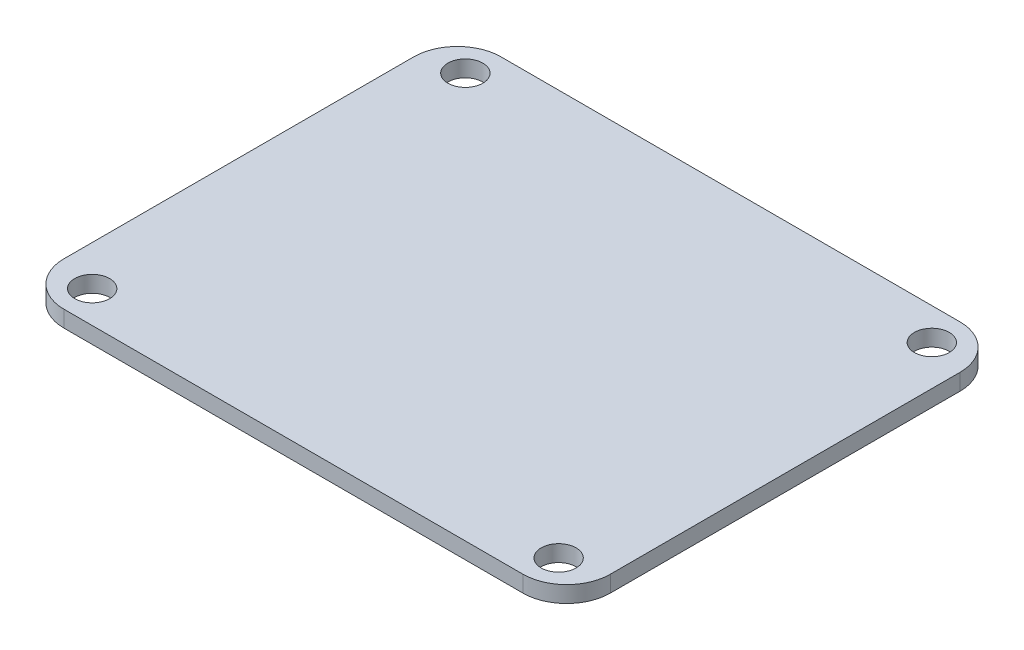
from build123d import *

# Parameters (mm, degrees)
SKETCH_1_R      = 1.597606998
EXTRUDE_1_DEPTH = 1.5


with BuildPart() as part:
    # Эскиз1 → Бобышка-Вытянуть1 (new body)
    with BuildSketch(Plane(origin=(0, 0, 0), x_dir=(1, 0, 0), z_dir=(0, 1, 0))):
        with BuildLine():
            Line((-16, -20), (26, -20))
            ThreePointArc((26, -20), (28.828427125, -18.828427125), (30, -16))
            Line((30, -16), (30, 16))
            ThreePointArc((30, 16), (28.828427125, 18.828427125), (26, 20))
            Line((26, 20), (-16, 20))
            ThreePointArc((-16, 20), (-18.828427125, 18.828427125), (-20, 16))
            Line((-20, 16), (-20, -16))
            ThreePointArc((-20, -16), (-18.828427125, -18.828427125), (-16, -20))
        make_face()
        with Locations(Location((-16.343796559, 17.075037247, 0), (0, 0, 270))):
            Circle(SKETCH_1_R, mode=Mode.SUBTRACT)
        with Locations(Location((26.343796559, -17.075037247, 0), (0, 0, 270))):
            Circle(SKETCH_1_R, mode=Mode.SUBTRACT)
        with Locations(Location((26.343796559, 17.075037247, 0), (0, 0, 90))):
            Circle(SKETCH_1_R, mode=Mode.SUBTRACT)
        with Locations(Location((-16.343796559, -17.075037247, 0), (0, 0, 90))):
            Circle(SKETCH_1_R, mode=Mode.SUBTRACT)
    extrude(amount=EXTRUDE_1_DEPTH)


solid = part.part
